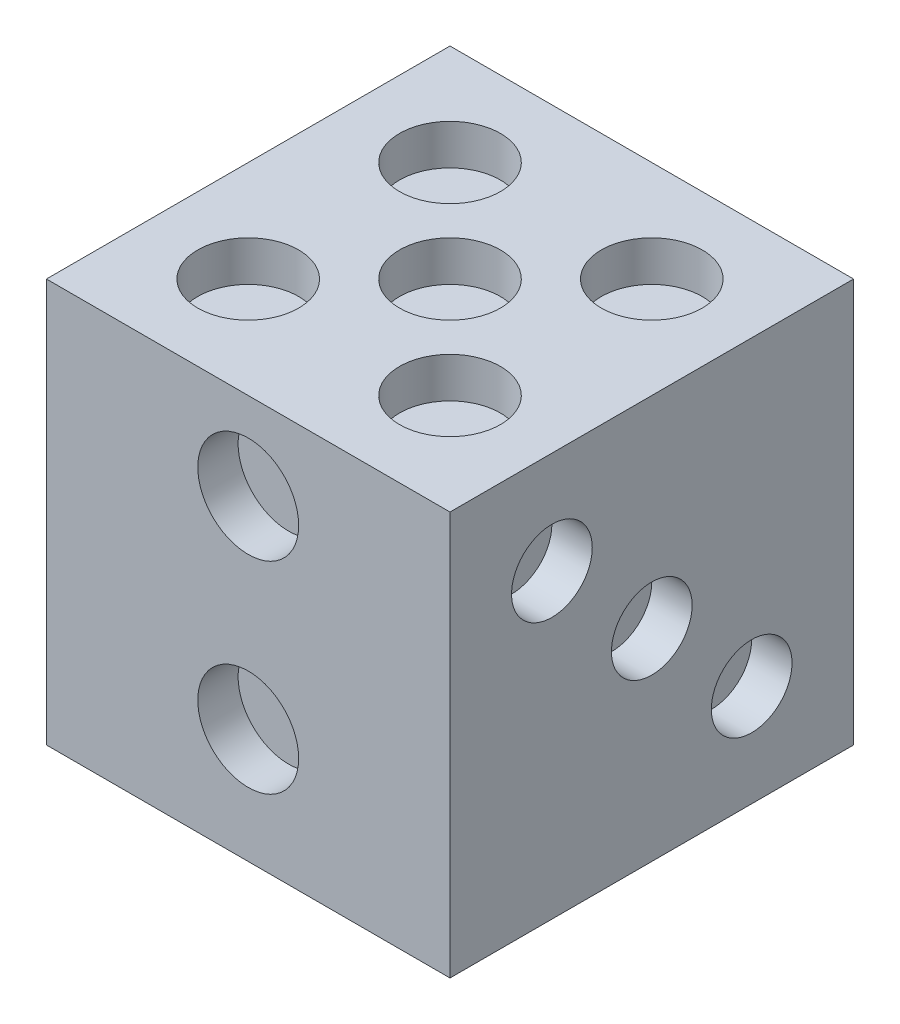
from build123d import *

# Parameters (mm, degrees)
SKETCH1_W           = 100
SKETCH1_H           = 100
BOSS_EXTRUDE1_DEPTH = 100
SKETCH2_R           = 15
CUT_EXTRUDE2_DEPTH  = 10
SKETCH3_R           = 10
CUT_EXTRUDE3_DEPTH  = 10
CUT_EXTRUDE5_DEPTH  = 10
SKETCH11_R          = 12.5
CUT_EXTRUDE6_DEPTH  = 10
SKETCH12_R          = 12.5
CUT_EXTRUDE7_DEPTH  = 10
SKETCH13_R          = 12
CUT_EXTRUDE12_DEPTH = 10


with BuildPart() as part:
    # Sketch1 → Boss-Extrude1 (new body)
    with BuildSketch(Plane(origin=(0, 0, 0), x_dir=(1, 0, 0), z_dir=(0, 1, 0))):
        with Locations((9.059630809, -2.226900841)):
            Rectangle(SKETCH1_W, SKETCH1_H)
    extrude(amount=BOSS_EXTRUDE1_DEPTH)

    # Sketch2 → Cut-Extrude2 (cut)
    with BuildSketch(Plane.XZ):
        with Locations(Location((10.537704993, 2.705564775, 0), (0, 0, 270))):
            Circle(SKETCH2_R)
    extrude(amount=-CUT_EXTRUDE2_DEPTH, mode=Mode.SUBTRACT)

    # Sketch3 → Cut-Extrude3 (cut)
    with BuildSketch(Plane(origin=(59.059630809, 0, 0), x_dir=(0, 0, -1), z_dir=(1, 0, 0))):
        with Locations((-2.226900841, 50)):
            Circle(SKETCH3_R)
        with Locations((22.5218365, 25.251262658)):
            Circle(SKETCH3_R)
        with Locations((-26.975638183, 74.748737342)):
            Circle(SKETCH3_R)
    extrude(amount=-CUT_EXTRUDE3_DEPTH, mode=Mode.SUBTRACT)

    # Sketch5 → Cut-Extrude5 (cut)
    with BuildSketch(Plane(origin=(0, 0, -47.773099159), x_dir=(-1, 0, 0), z_dir=(0, 0, -1))):
        with BuildLine():
            ThreePointArc((-34.059630809, 62.5), (-25.220796045, 66.161165235), (-21.559630809, 75))
            Line((-21.559630809, 75), (-34.059630809, 75))
            Line((-34.059630809, 75), (-34.059630809, 62.5))
        make_face()
        with BuildLine():
            Line((-34.059630809, 75), (-21.559630809, 75))
            ThreePointArc((-21.559630809, 75), (-42.898465574, 83.838834765), (-34.059630809, 62.5))
            Line((-34.059630809, 62.5), (-34.059630809, 75))
        make_face()
        with BuildLine():
            ThreePointArc((28.440369191, 75), (15.940369191, 87.5), (3.440369191, 75))
            Line((3.440369191, 75), (15.940369191, 75))
            Line((15.940369191, 75), (15.940369191, 62.5))
            ThreePointArc((15.940369191, 62.5), (24.779203955, 66.161165235), (28.440369191, 75))
        make_face()
        with BuildLine():
            Line((15.940369191, 75), (3.440369191, 75))
            ThreePointArc((3.440369191, 75), (7.101534426, 66.161165235), (15.940369191, 62.5))
            Line((15.940369191, 62.5), (15.940369191, 75))
        make_face()
        with BuildLine():
            ThreePointArc((-21.559630809, 25), (-25.220796045, 33.838834765), (-34.059630809, 37.5))
            Line((-34.059630809, 37.5), (-34.059630809, 25))
            Line((-34.059630809, 25), (-21.559630809, 25))
        make_face()
        with BuildLine():
            Line((-34.059630809, 25), (-34.059630809, 37.5))
            ThreePointArc((-34.059630809, 37.5), (-42.898465574, 16.161165235), (-21.559630809, 25))
            Line((-21.559630809, 25), (-34.059630809, 25))
        make_face()
        with BuildLine():
            ThreePointArc((28.440369191, 25), (24.779203955, 33.838834765), (15.940369191, 37.5))
            Line((15.940369191, 37.5), (15.940369191, 25))
            Line((15.940369191, 25), (3.440369191, 25))
            ThreePointArc((3.440369191, 25), (15.940369191, 12.5), (28.440369191, 25))
        make_face()
        with BuildLine():
            Line((15.940369191, 25), (15.940369191, 37.5))
            ThreePointArc((15.940369191, 37.5), (7.101534426, 33.838834765), (3.440369191, 25))
            Line((3.440369191, 25), (15.940369191, 25))
        make_face()
    extrude(amount=-CUT_EXTRUDE5_DEPTH, mode=Mode.SUBTRACT)

    # Sketch11 → Cut-Extrude6 (cut)
    with BuildSketch(Plane(origin=(0, 100, 0), x_dir=(1, 0, 0), z_dir=(0, 1, 0))):
        with Locations(Location((34.059630809, -27.226900841, 0), (0, 0, 270))):
            Circle(SKETCH11_R)
        with Locations(Location((34.059630809, 22.773099159, 0), (0, 0, 270))):
            Circle(SKETCH11_R)
        with Locations(Location((9.059630809, -2.226900841, 0), (0, 0, 270))):
            Circle(SKETCH11_R)
        with Locations(Location((-15.940369191, 22.773099159, 0), (0, 0, 270))):
            Circle(SKETCH11_R)
        with Locations(Location((-15.940369191, -27.226900841, 0), (0, 0, 270))):
            Circle(SKETCH11_R)
    extrude(amount=-CUT_EXTRUDE6_DEPTH, mode=Mode.SUBTRACT)

    # Sketch12 → Cut-Extrude7 (cut)
    with BuildSketch(Plane.XY.offset(52.226900841)):
        with Locations((9.059630809, 78.388490916)):
            Circle(SKETCH12_R)
        with Locations((9.059630809, 28.388490916)):
            Circle(SKETCH12_R)
    extrude(amount=-CUT_EXTRUDE7_DEPTH, mode=Mode.SUBTRACT)

    # Sketch13 → Cut-Extrude12 (cut)
    with BuildSketch(Plane.ZY.offset(40.940369191)):
        with Locations((-22.773099159, 25)):
            Circle(SKETCH13_R)
        with Locations((-22.773099159, 73.709409376)):
            Circle(SKETCH13_R)
        with Locations((2.226900841, 75)):
            Circle(SKETCH13_R)
        with Locations((2.226900841, 25)):
            Circle(SKETCH13_R)
        with Locations((27.226900841, 25)):
            Circle(SKETCH13_R)
        with Locations((27.226900841, 75)):
            Circle(SKETCH13_R)
    extrude(amount=-CUT_EXTRUDE12_DEPTH, mode=Mode.SUBTRACT)


solid = part.part
